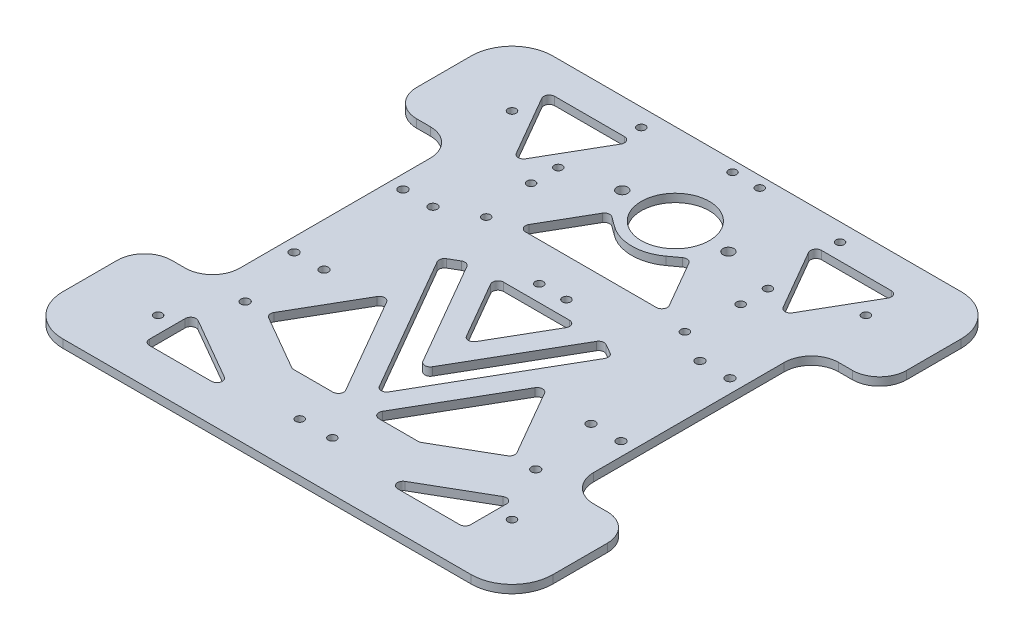
from build123d import *

# Parameters (mm, degrees)
SKETCH1_W             = 180
SKETCH1_H             = 180
BOSS_EXTRUDE1_DEPTH   = 3
FILLET1_R             = 15
SKETCH2_R             = 1.6
SKETCH2_W             = 25
SKETCH2_H             = 90
CUT_EXTRUDE2_DEPTH    = 128.314571044
FILLET2_R             = 10
HOLE_WIZARD_3_0_3_1_D = 3
HOLE_WIZARD_3_0_3_2_D = 3
HOLE_WIZARD_4_0_4_1_D = 4
SKETCH3_R             = 1.5
SKETCH3_R_2           = 1.6
CUT_EXTRUDE3_DEPTH    = 128.314571044
SKETCH4_R             = 1.5
CUT_EXTRUDE4_DEPTH    = 128.314571044
SKETCH5_R             = 12.5
CUT_EXTRUDE5_DEPTH    = 128.314571044
FILLET3_R             = 2


with BuildPart() as part:
    # Sketch1 → Boss-Extrude1 (new body)
    with BuildSketch(Plane(origin=(0, 0, 0), x_dir=(1, 0, 0), z_dir=(0, 1, 0))):
        Rectangle(SKETCH1_W, SKETCH1_H)
    extrude(amount=BOSS_EXTRUDE1_DEPTH)

    # Fillet1
    fillet1_edges = [part.edges().sort_by_distance(p)[0] for p in [
        (90, 1.5, 90),
        (-90, 1.5, 90),
        (-90, 1.5, -90),
        (90, 1.5, -90),
    ]]
    fillet(fillet1_edges, radius=FILLET1_R)

    # Sketch2 → Cut-Extrude2 (cut, through all)
    with BuildSketch(Plane(origin=(0, 3, 0), x_dir=(1, 0, 0), z_dir=(0, 1, 0))):
        with Locations(Location((-60.05, 20, 0), (0, 0, 270))):
            Circle(SKETCH2_R)
        with Locations(Location((-49.05, 20, 0), (0, 0, 270))):
            Circle(SKETCH2_R)
        with Locations(Location((-60.05, -20, 0), (0, 0, 270))):
            Circle(SKETCH2_R)
        with Locations(Location((-49.05, -20, 0), (0, 0, 270))):
            Circle(SKETCH2_R)
        with Locations(Location((49.05, 20, 0), (0, 0, 270))):
            Circle(SKETCH2_R)
        with Locations(Location((60.05, 20, 0), (0, 0, 270))):
            Circle(SKETCH2_R)
        with Locations(Location((49.05, -20, 0), (0, 0, 270))):
            Circle(SKETCH2_R)
        with Locations(Location((60.05, -20, 0), (0, 0, 270))):
            Circle(SKETCH2_R)
        with Locations((-77.5, 0)):
            Rectangle(SKETCH2_W, SKETCH2_H)
        with Locations((77.5, 0)):
            Rectangle(SKETCH2_W, SKETCH2_H)
    extrude(amount=-CUT_EXTRUDE2_DEPTH, mode=Mode.SUBTRACT)

    # Fillet2
    fillet2_edges = [part.edges().sort_by_distance(p)[0] for p in [
        (-65, 1.5, -45),
        (-65, 1.5, 45),
        (-90, 1.5, 45),
        (-90, 1.5, -45),
        (90, 1.5, -45),
        (90, 1.5, 45),
        (65, 1.5, 45),
        (65, 1.5, -45),
    ]]
    fillet(fillet2_edges, radius=FILLET2_R)

    # Диаметр отверстия Ø3.0 (3)1 (through all)
    with Locations(Plane(origin=(0, 3, 0), x_dir=(1, 0, 0), z_dir=(0, 1, 0))):
        with Locations((-65, -65), (-65, 65), (65, 65), (65, -65)):
            Hole(HOLE_WIZARD_3_0_3_1_D / 2)

    # Диаметр отверстия Ø3.0 (3)2 (through all)
    with Locations(Plane(origin=(0, 3, 0), x_dir=(1, 0, 0), z_dir=(0, 1, 0))):
        with Locations((-5, 15), (-38.5, 45.5), (-38.5, 55.5), (5, 15), (38.5, 45.5), (38.5, 55.5), (5, 86), (-5, 86)):
            Hole(HOLE_WIZARD_3_0_3_2_D / 2)

    # Диаметр отверстия Ø4.0 (4)1 (through all)
    with Locations(Plane(origin=(0, 3, 0), x_dir=(1, 0, 0), z_dir=(0, 1, 0))):
        with Locations((-19.5, 60), (19.5, 60)):
            Hole(HOLE_WIZARD_4_0_4_1_D / 2)

    # Sketch3 → Cut-Extrude3 (cut, through all)
    with BuildSketch(Plane(origin=(0, 3, 0), x_dir=(1, 0, 0), z_dir=(0, 1, 0))):
        with Locations(Location((-6, -72, 0), (0, 0, 270))):
            Circle(SKETCH3_R)
        with Locations(Location((6, -72, 0), (0, 0, 90))):
            Circle(SKETCH3_R)
        with Locations(Location((53.371589587, -44.65, 0), (0, 0, 270))):
            Circle(SKETCH3_R_2)
        with Locations(Location((-53.371589587, -44.65, 0), (0, 0, 270))):
            Circle(SKETCH3_R_2)
    extrude(amount=-CUT_EXTRUDE3_DEPTH, mode=Mode.SUBTRACT)

    # Sketch4 → Cut-Extrude4 (cut, through all)
    with BuildSketch(Plane(origin=(0, 3, 0), x_dir=(1, 0, 0), z_dir=(0, 1, 0))):
        with Locations(Location((-36, 83.5, 0), (0, 0, 270))):
            Circle(SKETCH4_R)
        with Locations(Location((37, 83.5, 0), (0, 0, 270))):
            Circle(SKETCH4_R)
        with Locations(Location((37, 26.5, 0), (0, 0, 270))):
            Circle(SKETCH4_R)
        with Locations(Location((-36, 26.5, 0), (0, 0, 270))):
            Circle(SKETCH4_R)
    extrude(amount=-CUT_EXTRUDE4_DEPTH, mode=Mode.SUBTRACT)

    # Sketch5 → Cut-Extrude5 (cut, through all)
    with BuildSketch(Plane(origin=(0, 3, 0), x_dir=(1, 0, 0), z_dir=(0, 1, 0))):
        with Locations(Location((0, 60, 0), (0, 0, 270))):
            Circle(SKETCH5_R)
        Polygon((31.754264805, 5), (0, -50), (-31.754264805, 5), (-24.826061575, 9), (0, -34), (24.826061575, 9), align=None)
        Polygon((0, -18), (15.588457268, 9), (-15.588457268, 9), align=None)
        Polygon((-5, -57.339745962), (-23.392304845, -57.339745962), (-45.598076211, -44.519237886), (-29, -15.770526581), align=None)
        Polygon((29, -15.770526581), (5, -57.339745962), (23.392304845, -57.339745962), (45.598076211, -44.519237886), align=None)
        with BuildLine():
            Line((-14.800549998, 50.996092632), (-27.5, 29))
            Line((-27.5, 29), (27.5, 29))
            Line((27.5, 29), (14.800549998, 50.996092632))
            Line((14.800549998, 50.996092632), (9.435897436, 47.078551181))
            ThreePointArc((9.435897436, 47.078551181), (0, 44), (-9.435897436, 47.078551181))
            Line((-9.435897436, 47.078551181), (-14.800549998, 50.996092632))
        make_face()
        Polygon((-59, -57.56624327), (-26.725386608, -76.2), (-59, -76.2), align=None)
        Polygon((-49.007586221, 49.3003268), (-32.726497308, 77.5), (-65.288675135, 77.5), align=None)
        Polygon((32.726497308, 77.5), (65.288675135, 77.5), (49.007586221, 49.3003268), align=None)
        Polygon((59, -57.56624327), (26.725386608, -76.2), (59, -76.2), align=None)
    extrude(amount=-CUT_EXTRUDE5_DEPTH, mode=Mode.SUBTRACT)

    # Fillet3
    fillet3_edges = [part.edges().sort_by_distance(p)[0] for p in [
        (0, 1.5, 18),
        (-15.588457268, 1.5, -9),
        (15.588457268, 1.5, -9),
        (-31.754264805, 1.5, -5),
        (-24.826061575, 1.5, -9),
        (0, 1.5, 34),
        (24.826061575, 1.5, -9),
        (31.754264805, 1.5, -5),
        (0, 1.5, 50),
        (-29, 1.5, 15.770526581),
        (-5, 1.5, 57.339745962),
        (-23.392304845, 1.5, 57.339745962),
        (-45.598076211, 1.5, 44.519237886),
        (29, 1.5, 15.770526581),
        (45.598076211, 1.5, 44.519237886),
        (23.392304845, 1.5, 57.339745962),
        (5, 1.5, 57.339745962),
        (27.5, 1.5, -29),
        (-27.5, 1.5, -29),
        (-14.800549998, 1.5, -50.996092632),
        (14.800549998, 1.5, -50.996092632),
        (-49.007586221, 1.5, -49.3003268),
        (-65.288675135, 1.5, -77.5),
        (-32.726497308, 1.5, -77.5),
        (49.007586221, 1.5, -49.3003268),
        (32.726497308, 1.5, -77.5),
        (65.288675135, 1.5, -77.5),
        (-59, 1.5, 76.2),
        (-59, 1.5, 57.56624327),
        (-26.725386608, 1.5, 76.2),
        (59, 1.5, 57.56624327),
        (59, 1.5, 76.2),
        (26.725386608, 1.5, 76.2),
    ]]
    fillet(fillet3_edges, radius=FILLET3_R)


solid = part.part
